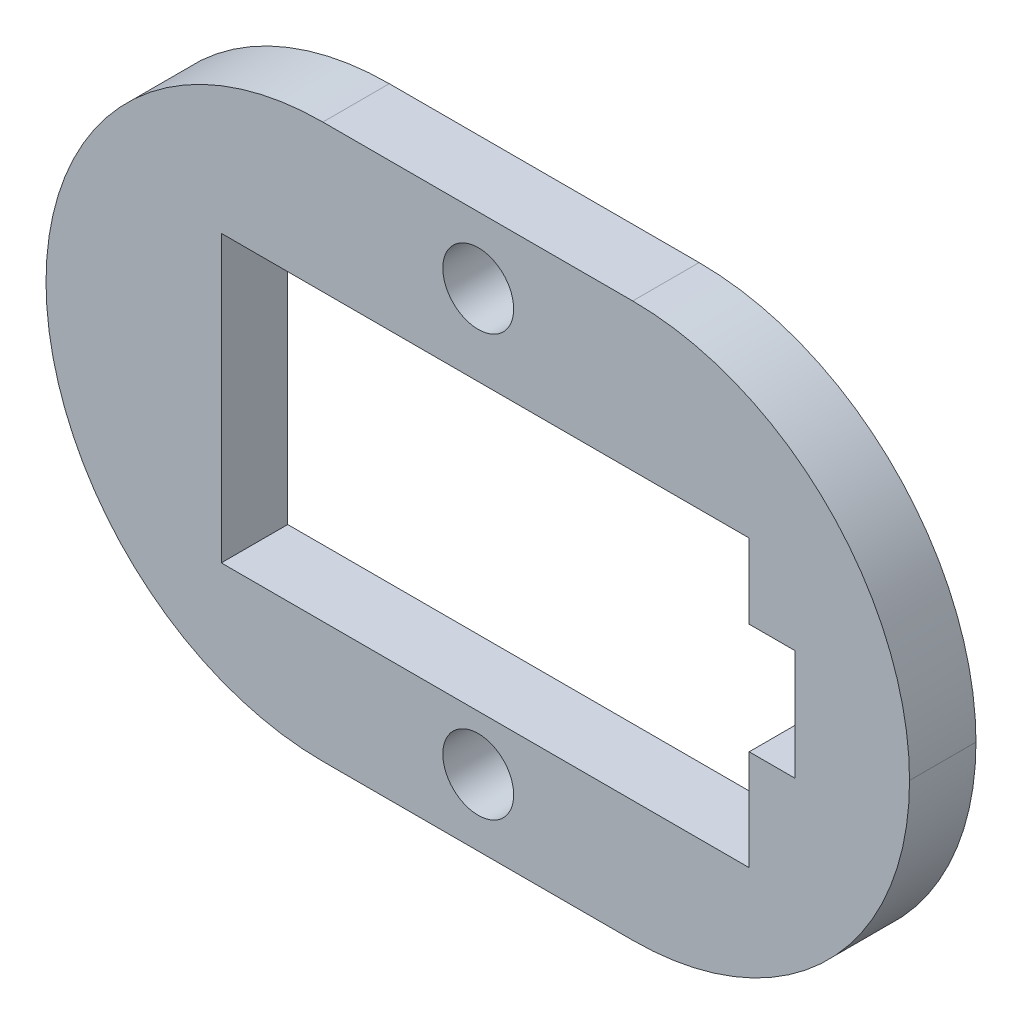
from build123d import *

# Parameters (mm, degrees)
SKETCH_1_R          = 1.3
EXTRUDE_1_DEPTH     = 3
SKETCH_2_R          = 1.6
CUT_EXTRUDE_1_DEPTH = 33.790082592
CHAMFER_1_SIZE      = 0.3


with BuildPart() as part:
    # 草图1 → 凸台-拉伸1 (new body)
    with BuildSketch(Plane(origin=(0, 0, 0), x_dir=(-1, 0, 0), z_dir=(0, 0, -1))):
        with BuildLine():
            Line((8.503321513, 25.001), (-5.486589193, 25.001))
            ThreePointArc((-5.486589193, 25.001), (-14.325423958, 21.339834765), (-17.986589193, 12.501))
            Line((-17.986589193, 12.501), (-17.986589193, 12.5))
            ThreePointArc((-17.986589193, 12.5), (-14.325423958, 3.661165235), (-5.486589193, 0))
            Line((-5.486589193, 0), (8.503321493, 0))
            ThreePointArc((8.503321493, 0), (17.342156257, 3.661165235), (21.003321493, 12.5))
            ThreePointArc((21.003321493, 12.5), (17.342509831, 21.339481206), (8.503321513, 25.001))
        make_face()
        with Locations(Location((1.487905971, 21.9995, 0), (0, 0, 180))):
            Circle(SKETCH_1_R, mode=Mode.SUBTRACT)
        with Locations(Location((1.487905971, 2.9995, 0), (0, 0, 180))):
            Circle(SKETCH_1_R, mode=Mode.SUBTRACT)
        Polygon((-12.805414109, 14.989684765), (-10.744590409, 14.989684765), (-10.744590409, 18.358619268), (13.089248936, 18.358619268), (13.089248936, 5.470232129), (-10.744590409, 5.470232129), (-10.744590409, 10.001), (-12.805414109, 10.001), align=None, mode=Mode.SUBTRACT)
    extrude(amount=-EXTRUDE_1_DEPTH)

    # 草图2 → 切除-拉伸1 (cut, through all)
    with BuildSketch(Plane.XY.offset(3)):
        with Locations((-1.487905971, 21.9995)):
            Circle(SKETCH_2_R)
        with Locations((-1.487905971, 2.9995)):
            Circle(SKETCH_2_R)
    extrude(amount=-CUT_EXTRUDE_1_DEPTH, mode=Mode.SUBTRACT)

    # 倒角1
    chamfer_1_edges = [part.edges().sort_by_distance(p)[0] for p in [
        (-3.087905971, 21.9995, 0),
        (-3.087905971, 2.9995, 0),
    ]]
    chamfer(chamfer_1_edges, length=CHAMFER_1_SIZE)


solid = part.part
